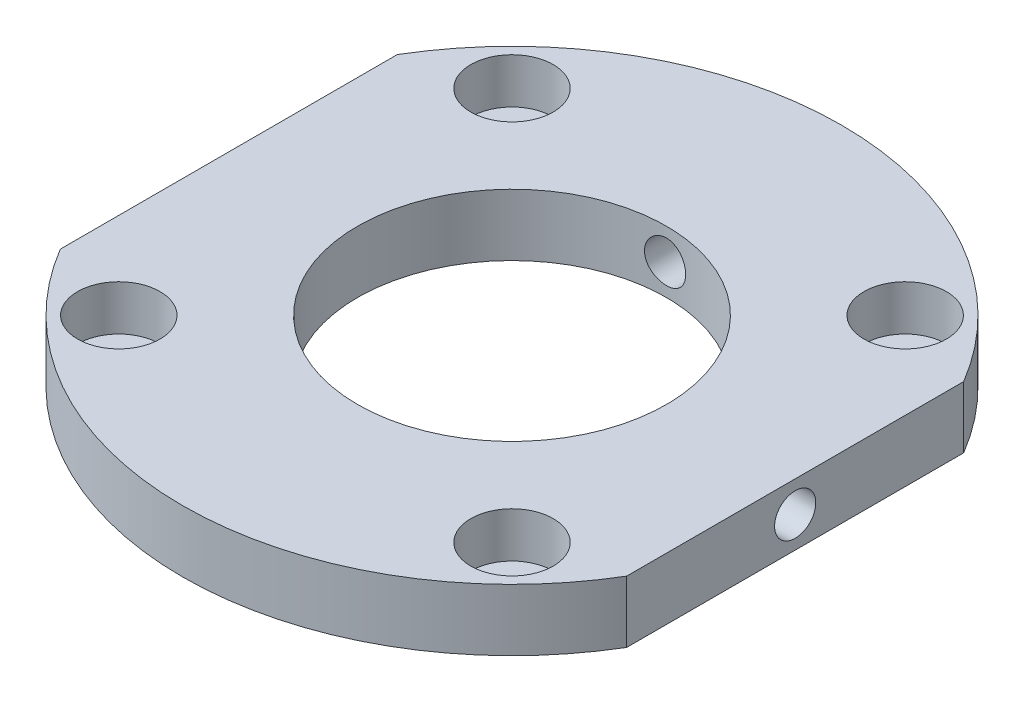
from build123d import *

# Parameters (mm, degrees)
SKETCH1_R                                           = 32
SKETCH1_R_2                                         = 15
BOSS_EXTRUDE1_DEPTH                                 = 6
CBORE_FOR_M4_HEX_SOCKET_HEAD_CAP_SCREW2_D           = 4.3
CBORE_FOR_M4_HEX_SOCKET_HEAD_CAP_SCREW2_DEPTH       = 11.94
CBORE_FOR_M4_HEX_SOCKET_HEAD_CAP_SCREW2_CBORE_D     = 8
CBORE_FOR_M4_HEX_SOCKET_HEAD_CAP_SCREW2_CBORE_DEPTH = 4.4
CBORE_FOR_M4_HEX_SOCKET_HEAD_CAP_SCREW2_TIP         = 1.291850331
SKETCH7_R                                           = 2
CUT_EXTRUDE1_DEPTH                                  = 44.5
SKETCH8_R                                           = 2
CUT_EXTRUDE2_DEPTH                                  = 44.5
CUT_EXTRUDE3_START                                  = -10
CUT_EXTRUDE3_DEPTH                                  = 10


with BuildPart() as part:
    # Sketch1 → Boss-Extrude1 (new body)
    with BuildSketch(Plane(origin=(0, 0, 0), x_dir=(1, 0, 0), z_dir=(0, 1, 0))):
        with Locations(Location((0, 0, 0), (0, 0, 270))):
            Circle(SKETCH1_R)
        with Locations(Location((0, 0, 0), (0, 0, 270))):
            Circle(SKETCH1_R_2, mode=Mode.SUBTRACT)
    extrude(amount=BOSS_EXTRUDE1_DEPTH)

    # CBORE for M4 Hex Socket Head Cap Screw2
    with Locations(Plane(origin=(0, 6, 0), x_dir=(1, 0, 0), z_dir=(0, 1, 0))):
        with Locations((19.091883092, 19.091883092), (19.091883092, -19.091883092), (-19.091883092, -19.091883092), (-19.091883092, 19.091883092)):
            CounterBoreHole(CBORE_FOR_M4_HEX_SOCKET_HEAD_CAP_SCREW2_D / 2, CBORE_FOR_M4_HEX_SOCKET_HEAD_CAP_SCREW2_CBORE_D / 2, CBORE_FOR_M4_HEX_SOCKET_HEAD_CAP_SCREW2_CBORE_DEPTH, depth=CBORE_FOR_M4_HEX_SOCKET_HEAD_CAP_SCREW2_DEPTH)
            with Locations((0, 0, -(CBORE_FOR_M4_HEX_SOCKET_HEAD_CAP_SCREW2_DEPTH + CBORE_FOR_M4_HEX_SOCKET_HEAD_CAP_SCREW2_TIP / 2))):  # 118° drill point
                Cone(0, CBORE_FOR_M4_HEX_SOCKET_HEAD_CAP_SCREW2_D / 2, CBORE_FOR_M4_HEX_SOCKET_HEAD_CAP_SCREW2_TIP, mode=Mode.SUBTRACT)

    # Sketch7 → Cut-Extrude1 (cut)
    with BuildSketch(Plane(origin=(0, 0, 0), x_dir=(0, 0, -1), z_dir=(1, 0, 0))):
        with Locations(Location((0, 3, 0), (0, 0, 180))):
            Circle(SKETCH7_R)
    extrude(amount=CUT_EXTRUDE1_DEPTH, mode=Mode.SUBTRACT)

    # Sketch8 → Cut-Extrude2 (cut)
    with BuildSketch(Plane.XY):
        with Locations(Location((0, 3, 0), (0, 0, 90))):
            Circle(SKETCH8_R)
    extrude(amount=-CUT_EXTRUDE2_DEPTH, mode=Mode.SUBTRACT)

    # Sketch9 → Cut-Extrude3 (cut)
    with BuildSketch(Plane(origin=(0, 6, 0), x_dir=(1, 0, 0), z_dir=(0, 1, 0)).offset(CUT_EXTRUDE3_START)):
        with BuildLine():
            Line((-27.5, 16.363068172), (-27.5, -16.363068172))
            ThreePointArc((-27.5, -16.363068172), (-32, 0), (-27.5, 16.363068172))
        make_face()
        with BuildLine():
            Line((27.5, -16.363068172), (27.5, 16.363068172))
            ThreePointArc((27.5, 16.363068172), (32, 0), (27.5, -16.363068172))
        make_face()
    extrude(amount=CUT_EXTRUDE3_DEPTH, mode=Mode.SUBTRACT)


solid = part.part
